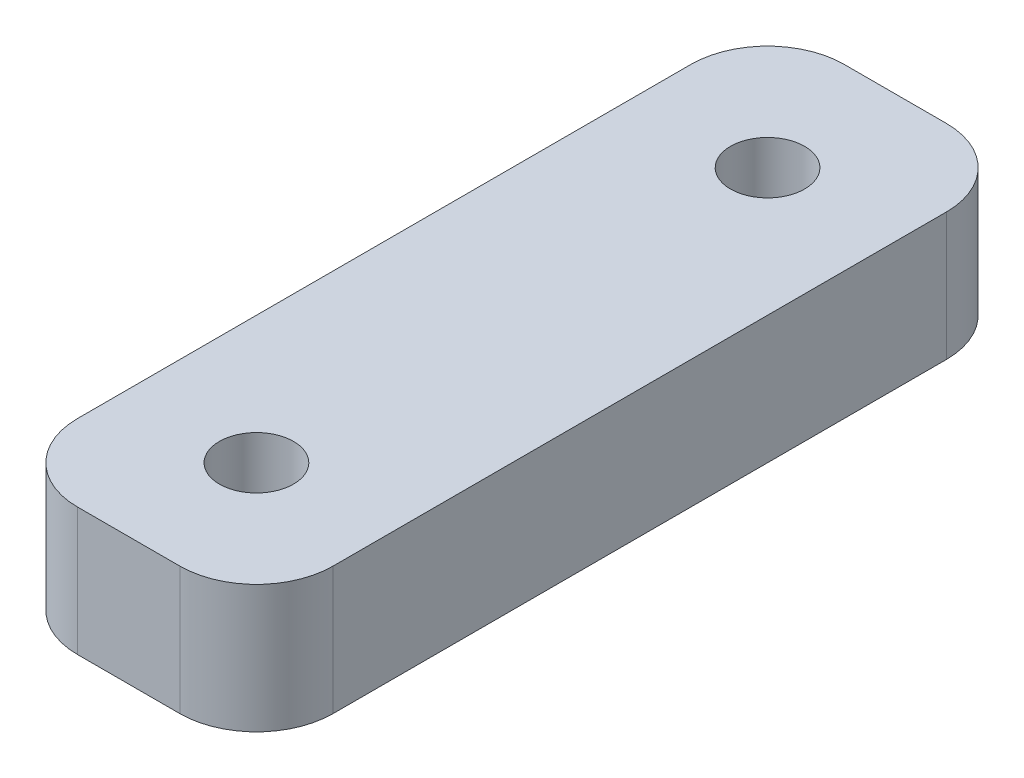
from build123d import *

# Parameters (mm, degrees)
SKETCH1_W           = 10
SKETCH1_H           = 30
SKETCH1_R           = 1.45
BOSS_EXTRUDE1_DEPTH = 5
FILLET1_R           = 3


with BuildPart() as part:
    # Sketch1 → Boss-Extrude1 (new body)
    with BuildSketch(Plane(origin=(0, 0, 0), x_dir=(1, 0, 0), z_dir=(0, 1, 0))):
        with Locations((8, 15)):
            Rectangle(SKETCH1_W, SKETCH1_H)
        with Locations(Location((8, 25, 0), (0, 0, 270))):
            Circle(SKETCH1_R, mode=Mode.SUBTRACT)
        with Locations(Location((8, 5, 0), (0, 0, 270))):
            Circle(SKETCH1_R, mode=Mode.SUBTRACT)
    extrude(amount=BOSS_EXTRUDE1_DEPTH)

    # Fillet1
    fillet1_edges = [part.edges().sort_by_distance(p)[0] for p in [
        (3, 2.5, -30),
        (13, 2.5, -30),
        (13, 2.5, 0),
        (3, 2.5, 0),
    ]]
    fillet(fillet1_edges, radius=FILLET1_R)


solid = part.part
